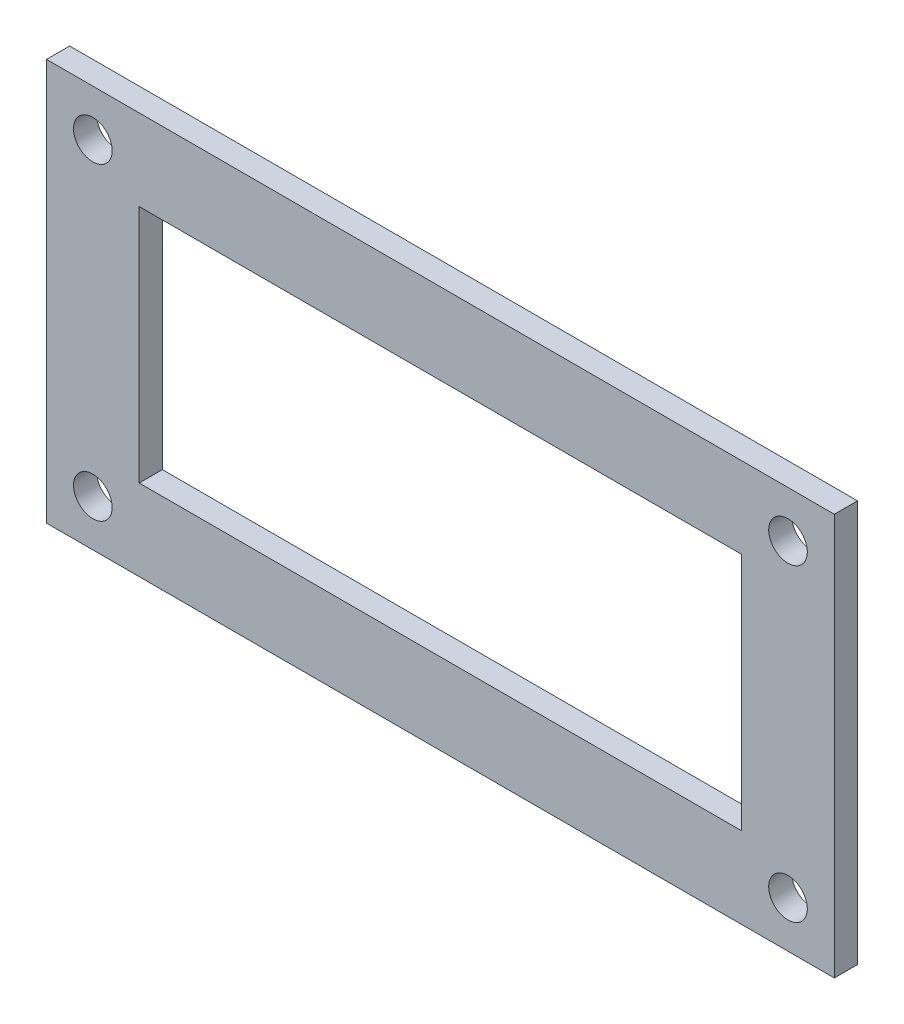
from build123d import *

# Parameters (mm, degrees)
SKETCH1_W           = 102
SKETCH1_H           = 52
SKETCH1_W_2         = 78
SKETCH1_H_2         = 31
BOSS_EXTRUDE1_DEPTH = 3
SKETCH2_R           = 2.5
CUT_EXTRUDE6_DEPTH  = 31


with BuildPart() as part:
    # Sketch1 → Boss-Extrude1 (new body)
    with BuildSketch(Plane.XY):
        Rectangle(SKETCH1_W, SKETCH1_H)
        Rectangle(SKETCH1_W_2, SKETCH1_H_2, mode=Mode.SUBTRACT)
    extrude(amount=BOSS_EXTRUDE1_DEPTH)

    # Sketch2 → Cut-Extrude6 (cut)
    with BuildSketch(Plane.XY):
        with Locations(Location((-45, 20, 0), (0, 0, 180))):
            Circle(SKETCH2_R)
        with Locations(Location((-45, -20, 0), (0, 0, 180))):
            Circle(SKETCH2_R)
        with Locations(Location((45, -20, 0), (0, 0, 180))):
            Circle(SKETCH2_R)
        with Locations(Location((45, 20, 0), (0, 0, 180))):
            Circle(SKETCH2_R)
    extrude(amount=CUT_EXTRUDE6_DEPTH, mode=Mode.SUBTRACT)


solid = part.part
